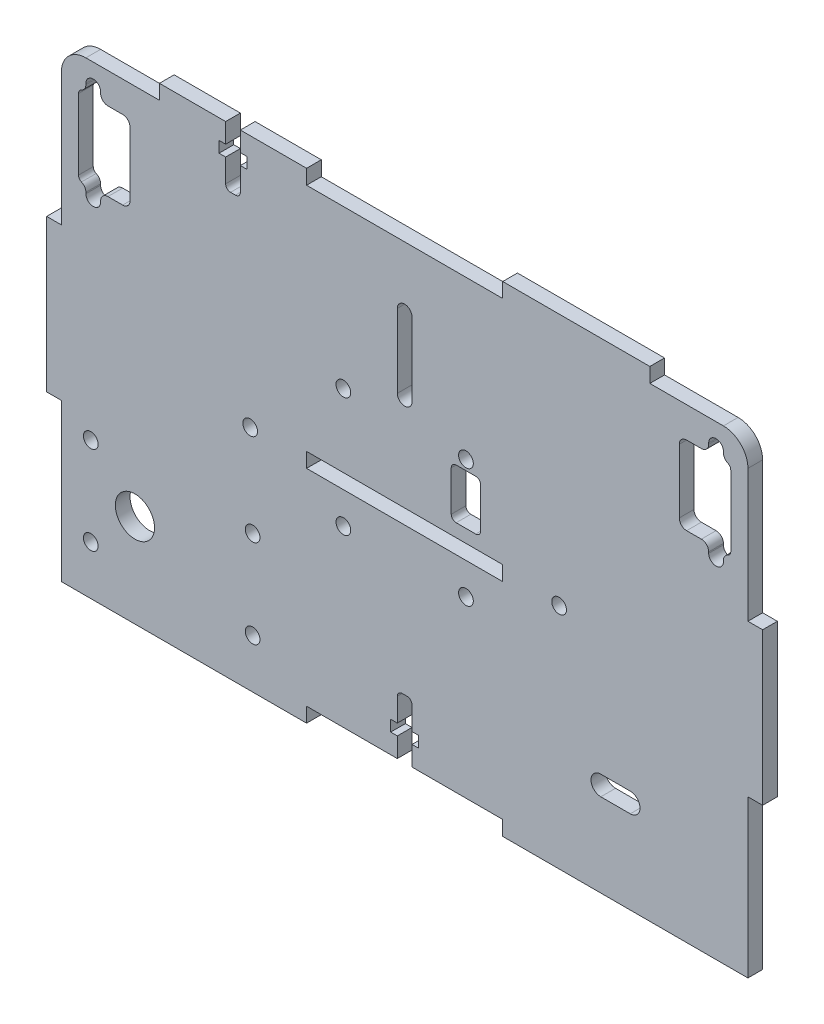
from build123d import *

# Parameters (mm, degrees)
ESBO_O1_W                   = 140
ESBO_O1_H                   = 95
RESSALTO_EXTRUS_O1_DEPTH    = 1.5
ESBO_O2_R                   = 1.5
ESBO_O2_W                   = 40
ESBO_O2_H                   = 3
CORTE_EXTRUS_O1_DEPTH       = 85.647799735
ESBO_O3_W                   = 3
ESBO_O3_H                   = 31
ESBO_O3_W_2                 = 30
ESBO_O3_H_2                 = 3
RESSALTO_EXTRUS_O2_DEPTH    = 3
CORTE_EXTRUS_O11_DEPTH      = 89.815820663
CORTE_EXTRUS_O11_DEPTH_BACK = 89.815820663
ESBO_O30_R                  = 4
CORTE_EXTRUS_O12_DEPTH      = 89.815820663
CORTE_EXTRUS_O12_DEPTH_BACK = 89.815820663
ESBO_O31_R                  = 1.5
CORTE_EXTRUS_O2_DEPTH       = 89.815820663
CUT_EXTRUDE2_DEPTH          = 89.777812543
CUT_EXTRUDE2_DEPTH_BACK     = 89.777812543
CUT_EXTRUDE6_DEPTH          = 89.815820663
CUT_EXTRUDE6_DEPTH_BACK     = 89.815820663
CUT_EXTRUDE8_DEPTH          = 89.777812543
CUT_EXTRUDE8_DEPTH_BACK     = 89.777812543
CUT_EXTRUDE9_DEPTH          = 89.815820663
CUT_EXTRUDE12_DEPTH         = 89.777812543
CUT_EXTRUDE12_DEPTH_BACK    = 89.777812543
SKETCH16_R                  = 1.5
FILLET1_R                   = 5


with BuildPart() as part:
    # Esboço1 → Ressalto-extrusão1 (new, symmetric)
    with BuildSketch(Plane.XY):
        Rectangle(ESBO_O1_W, ESBO_O1_H)
    extrude(amount=RESSALTO_EXTRUS_O1_DEPTH, both=True)

    # Esboço2 → Corte-extrusão1 (cut, through all)
    with BuildSketch(Plane.XY.offset(1.5)):
        with Locations((-31.5, -1)):
            Circle(ESBO_O2_R)
        with Locations(Location((31.5, -1, 0), (0, 0, 180))):
            Circle(ESBO_O2_R)
        with Locations((0, -46)):
            Rectangle(ESBO_O2_W, ESBO_O2_H)
        with Locations((0, -1)):
            Rectangle(ESBO_O2_W, ESBO_O2_H)
    extrude(amount=-CORTE_EXTRUS_O1_DEPTH, mode=Mode.SUBTRACT)

    # Esboço3 → Ressalto-extrusão2 (add, through all)
    with BuildSketch(Plane.XY.offset(1.5)):
        with Locations((71.5, 0)):
            Rectangle(ESBO_O3_W, ESBO_O3_H)
        with Locations((-71.5, 0)):
            Rectangle(ESBO_O3_W, ESBO_O3_H)
        with Locations((-35, 49)):
            Rectangle(ESBO_O3_W_2, ESBO_O3_H_2)
        with Locations((35, 49)):
            Rectangle(ESBO_O3_W_2, ESBO_O3_H_2)
    extrude(amount=-RESSALTO_EXTRUS_O2_DEPTH)

    # Esboço30 → Corte-extrusão11 (cut, two sides: drawn at the far end of the back side and taken through both)
    with BuildSketch(Plane(origin=(0, 0, -1.5), x_dir=(-1, 0, 0), z_dir=(0, 0, -1)).offset(-CORTE_EXTRUS_O11_DEPTH_BACK)):
        with Locations((55, -28.5)):
            Circle(ESBO_O30_R)
    extrude(amount=CORTE_EXTRUS_O11_DEPTH + CORTE_EXTRUS_O11_DEPTH_BACK, mode=Mode.SUBTRACT)

    # Esboço31 → Corte-extrusão12 (cut, two sides: drawn at the far end of the back side and taken through both)
    with BuildSketch(Plane(origin=(0, 0, -1.5), x_dir=(-1, 0, 0), z_dir=(0, 0, -1)).offset(-CORTE_EXTRUS_O12_DEPTH_BACK)):
        with Locations((64, -19.5)):
            Circle(ESBO_O31_R)
        with Locations((64, -37.5)):
            Circle(ESBO_O31_R)
        with Locations((31, -19.5)):
            Circle(ESBO_O31_R)
        with Locations((31, -37.5)):
            Circle(ESBO_O31_R)
    extrude(amount=CORTE_EXTRUS_O12_DEPTH + CORTE_EXTRUS_O12_DEPTH_BACK, mode=Mode.SUBTRACT)

    # Esboço4 → Corte-extrusão2 (cut, through all)
    with BuildSketch(Plane.XY.offset(1.5)):
        with BuildLine():
            Line((40, -26.5), (46, -26.5))
            ThreePointArc((46, -26.5), (48, -28.5), (46, -30.5))
            Line((46, -30.5), (40, -30.5))
            ThreePointArc((40, -30.5), (38, -28.5), (40, -26.5))
        make_face()
    extrude(amount=-CORTE_EXTRUS_O2_DEPTH, mode=Mode.SUBTRACT)

    # Sketch5 → Cut-Extrude2 (cut, two sides: drawn at the far end of the back side and taken through both)
    with BuildSketch(Plane.XY.offset(-CUT_EXTRUDE2_DEPTH_BACK)):
        with BuildLine():
            Line((-1.5, -44.5), (1.5, -44.5))
            Line((1.5, -44.5), (1.5, -40.5))
            Line((1.5, -40.5), (2.85, -40.5))
            Line((2.85, -40.5), (2.85, -38.23))
            Line((2.85, -38.23), (1.5, -38.23))
            Line((1.5, -38.23), (1.5, -33.5))
            ThreePointArc((1.5, -33.5), (1.207106781, -32.792893219), (0.5, -32.5))
            Line((0.5, -32.5), (-0.5, -32.5))
            ThreePointArc((-0.5, -32.5), (-1.207106781, -32.792893219), (-1.5, -33.5))
            Line((-1.5, -33.5), (-1.5, -38.23))
            Line((-1.5, -38.23), (-2.85, -38.23))
            Line((-2.85, -38.23), (-2.85, -40.5))
            Line((-2.85, -40.5), (-1.5, -40.5))
            Line((-1.5, -40.5), (-1.5, -44.5))
        make_face()
    extrude(amount=CUT_EXTRUDE2_DEPTH + CUT_EXTRUDE2_DEPTH_BACK, mode=Mode.SUBTRACT)

    # Sketch8 → Cut-Extrude6 (cut, two sides: drawn at the far end of the back side and taken through both)
    with BuildSketch(Plane.XY.offset(1.5).offset(-CUT_EXTRUDE6_DEPTH_BACK)):
        with BuildLine():
            Line((-56, 39.75), (-56, 26.75))
            ThreePointArc((-56, 26.75), (-56.439339828, 25.689339828), (-57.5, 25.25))
            Line((-57.5, 25.25), (-60.5, 25.25))
            ThreePointArc((-60.5, 25.25), (-61.560660172, 24.810660172), (-62, 23.75))
            Line((-62, 23.75), (-62, 23.5))
            ThreePointArc((-62, 23.5), (-63.5, 22), (-65, 23.5))
            Line((-65, 23.5), (-65, 23.75))
            ThreePointArc((-65, 23.75), (-65.24500996, 24.571583836), (-65.9, 25.124772708))
            ThreePointArc((-65.9, 25.124772708), (-66.336660027, 25.49356529), (-66.5, 26.041287847))
            Line((-66.5, 26.041287847), (-66.5, 40.458712153))
            ThreePointArc((-66.5, 40.458712153), (-66.336660027, 41.00643471), (-65.9, 41.375227292))
            ThreePointArc((-65.9, 41.375227292), (-65.24500996, 41.928416164), (-65, 42.75))
            Line((-65, 42.75), (-65, 43))
            ThreePointArc((-65, 43), (-63.5, 44.5), (-62, 43))
            Line((-62, 43), (-62, 42.75))
            ThreePointArc((-62, 42.75), (-61.560660172, 41.689339828), (-60.5, 41.25))
            Line((-60.5, 41.25), (-57.5, 41.25))
            ThreePointArc((-57.5, 41.25), (-56.439339828, 40.810660172), (-56, 39.75))
        make_face()
        with BuildLine():
            Line((56, 39.75), (56, 26.75))
            ThreePointArc((56, 26.75), (56.439339828, 25.689339828), (57.5, 25.25))
            Line((57.5, 25.25), (60.5, 25.25))
            ThreePointArc((60.5, 25.25), (61.560660172, 24.810660172), (62, 23.75))
            Line((62, 23.75), (62, 23.5))
            ThreePointArc((62, 23.5), (63.5, 22), (65, 23.5))
            Line((65, 23.5), (65, 23.75))
            ThreePointArc((65, 23.75), (65.24500996, 24.571583836), (65.9, 25.124772708))
            ThreePointArc((65.9, 25.124772708), (66.336660027, 25.49356529), (66.5, 26.041287847))
            Line((66.5, 26.041287847), (66.5, 40.458712153))
            ThreePointArc((66.5, 40.458712153), (66.336660027, 41.00643471), (65.9, 41.375227292))
            ThreePointArc((65.9, 41.375227292), (65.24500996, 41.928416164), (65, 42.75))
            Line((65, 42.75), (65, 43))
            ThreePointArc((65, 43), (63.5, 44.5), (62, 43))
            Line((62, 43), (62, 42.75))
            ThreePointArc((62, 42.75), (61.560660172, 41.689339828), (60.5, 41.25))
            Line((60.5, 41.25), (57.5, 41.25))
            ThreePointArc((57.5, 41.25), (56.439339828, 40.810660172), (56, 39.75))
        make_face()
    extrude(amount=CUT_EXTRUDE6_DEPTH + CUT_EXTRUDE6_DEPTH_BACK, mode=Mode.SUBTRACT)

    # Sketch11 → Cut-Extrude8 (cut, two sides: drawn at the far end of the back side and taken through both)
    with BuildSketch(Plane.XY.offset(-CUT_EXTRUDE8_DEPTH_BACK)):
        with BuildLine():
            Line((-36.5, 50.5), (-33.5, 50.5))
            Line((-33.5, 50.5), (-33.5, 46.5))
            Line((-33.5, 46.5), (-32.15, 46.5))
            Line((-32.15, 46.5), (-32.15, 44.23))
            Line((-32.15, 44.23), (-33.5, 44.23))
            Line((-33.5, 44.23), (-33.5, 39.5))
            ThreePointArc((-33.5, 39.5), (-33.792893219, 38.792893219), (-34.5, 38.5))
            Line((-34.5, 38.5), (-35.5, 38.5))
            ThreePointArc((-35.5, 38.5), (-36.207106781, 38.792893219), (-36.5, 39.5))
            Line((-36.5, 39.5), (-36.5, 44.23))
            Line((-36.5, 44.23), (-37.85, 44.23))
            Line((-37.85, 44.23), (-37.85, 46.5))
            Line((-37.85, 46.5), (-36.5, 46.5))
            Line((-36.5, 46.5), (-36.5, 50.5))
        make_face()
    extrude(amount=CUT_EXTRUDE8_DEPTH + CUT_EXTRUDE8_DEPTH_BACK, mode=Mode.SUBTRACT)

    # Sketch12 → Cut-Extrude9 (cut, through all)
    with BuildSketch(Plane.XY.offset(1.5)):
        with BuildLine():
            Line((-1.5, 20), (-1.5, 35))
            ThreePointArc((-1.5, 35), (0, 36.5), (1.5, 35))
            Line((1.5, 35), (1.5, 20))
            ThreePointArc((1.5, 20), (0, 18.5), (-1.5, 20))
        make_face()
    extrude(amount=-CUT_EXTRUDE9_DEPTH, mode=Mode.SUBTRACT)

    # Sketch16 → Cut-Extrude12 (cut, two sides: drawn at the far end of the back side and taken through both)
    with BuildSketch(Plane.XY.offset(-CUT_EXTRUDE12_DEPTH_BACK)):
        with Locations((-12.5, 15.35)):
            Circle(SKETCH16_R)
        with Locations((12.5, 15.35)):
            Circle(SKETCH16_R)
        with Locations((-12.5, -8.95)):
            Circle(SKETCH16_R)
        with Locations((12.5, -8.95)):
            Circle(SKETCH16_R)
        with BuildLine():
            Line((10.5, 13.35), (14.5, 13.35))
            ThreePointArc((14.5, 13.35), (15.207106781, 13.057106781), (15.5, 12.35))
            Line((15.5, 12.35), (15.5, 4.15))
            ThreePointArc((15.5, 4.15), (15.207106781, 3.442893219), (14.5, 3.15))
            Line((14.5, 3.15), (10.5, 3.15))
            ThreePointArc((10.5, 3.15), (9.792893219, 3.442893219), (9.5, 4.15))
            Line((9.5, 4.15), (9.5, 12.35))
            ThreePointArc((9.5, 12.35), (9.792893219, 13.057106781), (10.5, 13.35))
        make_face()
    extrude(amount=CUT_EXTRUDE12_DEPTH + CUT_EXTRUDE12_DEPTH_BACK, mode=Mode.SUBTRACT)

    # Fillet1
    fillet1_edges = [part.edges().sort_by_distance(p)[0] for p in [
        (-70, 47.5, 0),
        (70, 47.5, 0),
    ]]
    fillet(fillet1_edges, radius=FILLET1_R)


solid = part.part
